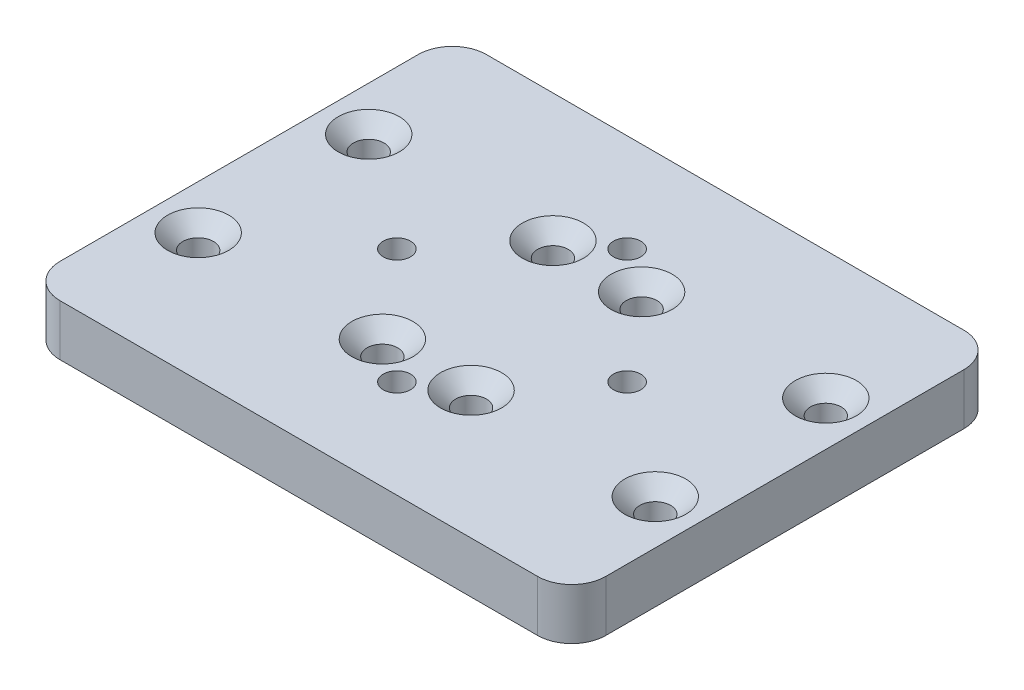
from build123d import *

# Parameters (mm, degrees)
DODANIE_WYCI_GNI_CIE1_DEPTH                        = 15
SZKIC2_R                                           = 4
WYTNIJ_WYCI_GNI_CIE1_DEPTH                         = 103.621878759
LUSTRO2_COPY_1_SKETCH_R                            = 4
LUSTRO2_COPY_1_DEPTH                               = 103.621878759
SFAZOWANIE1_SIZE                                   = 0.5
POG_BIENIE_STO_KOWE_POD_M8_WKR_T_Z_BEM_D           = 9
POG_BIENIE_STO_KOWE_POD_M8_WKR_T_Z_BEM_CSINK_D     = 17.92
POG_BIENIE_STO_KOWE_POD_M8_WKR_T_Z_BEM_CSINK_ANGLE = 90
SZKIC5_R                                           = 4
WYTNIJ_WYCI_GNI_CIE2_DEPTH                         = 103.621878759


with BuildPart() as part:
    # Szkic1 → Dodanie-wyciągnięcie1 (new body)
    with BuildSketch(Plane(origin=(0, 0, 0), x_dir=(1, 0, 0), z_dir=(0, 1, 0))):
        with BuildLine():
            Line((-70, -62.5), (70, -62.5))
            ThreePointArc((70, -62.5), (77.071067812, -59.571067812), (80, -52.5))
            Line((80, -52.5), (80, 52.5))
            ThreePointArc((80, 52.5), (77.071067812, 59.571067812), (70, 62.5))
            Line((70, 62.5), (-70, 62.5))
            ThreePointArc((-70, 62.5), (-77.071067812, 59.571067812), (-80, 52.5))
            Line((-80, 52.5), (-80, -52.5))
            ThreePointArc((-80, -52.5), (-77.071067812, -59.571067812), (-70, -62.5))
        make_face()
    extrude(amount=DODANIE_WYCI_GNI_CIE1_DEPTH)

    # Szkic2 → Wytnij-wyciągnięcie1 (cut, symmetric)
    with BuildSketch(Plane(origin=(0, 15, 0), x_dir=(1, 0, 0), z_dir=(0, 1, 0))):
        with Locations(Location((-67, -25, 0), (0, 0, 270))):
            Circle(SZKIC2_R)
        with Locations(Location((-13, -25, 0), (0, 0, 90))):
            Circle(SZKIC2_R)
    wytnij_wyci_gni_cie1 = extrude(amount=WYTNIJ_WYCI_GNI_CIE1_DEPTH, both=True, mode=Mode.SUBTRACT)

    # Lustro1: Wytnij-wyciągnięcie1 across plane
    add(wytnij_wyci_gni_cie1.mirror(Plane.XY), mode=Mode.SUBTRACT)

    # Lustro2: Wytnij-wyciągnięcie1 across plane
    add(wytnij_wyci_gni_cie1.mirror(Plane(origin=(0, 0, 0), x_dir=(0, 0, 1), z_dir=(1, 0, 0))), mode=Mode.SUBTRACT)

    # Lustro2 copy 1 sketch → Lustro2 copy 1 (cut, symmetric)
    with BuildSketch(Plane(origin=(0, 15, 0), x_dir=(-1, 0, 0), z_dir=(0, 1, 0))):
        with Locations(Location((-67, -25, 0), (0, 0, 270))):
            Circle(LUSTRO2_COPY_1_SKETCH_R)
        with Locations(Location((-13, -25, 0), (0, 0, 90))):
            Circle(LUSTRO2_COPY_1_SKETCH_R)
    extrude(amount=LUSTRO2_COPY_1_DEPTH, both=True, mode=Mode.SUBTRACT)

    # Sfazowanie1
    sfazowanie1_edges = [part.edges().sort_by_distance(p)[0] for p in [
        (-67, 0, 21),
        (-67, 15, 21),
        (-13, 0, 29),
        (-13, 15, 29),
        (-67, 15, -21),
        (-67, 0, -21),
        (-13, 15, -29),
        (-13, 0, -29),
        (67, 0, -21),
        (67, 15, -21),
        (13, 0, -29),
        (13, 15, -29),
        (67, 15, 21),
        (67, 0, 21),
        (13, 15, 29),
        (13, 0, 29),
    ]]
    chamfer(sfazowanie1_edges, length=SFAZOWANIE1_SIZE)

    # Pogłębienie stożkowe pod M8 Wkręt z łbem stożkowym płaskim1 (through all)
    with Locations(Plane(origin=(0, 15, 0), x_dir=(1, 0, 0), z_dir=(0, 1, 0))):
        with Locations((-67, 25), (-13, 25), (-13, -25), (13, -25), (13, 25), (67, 25), (67, -25), (-67, -25)):
            CounterSinkHole(POG_BIENIE_STO_KOWE_POD_M8_WKR_T_Z_BEM_D / 2, POG_BIENIE_STO_KOWE_POD_M8_WKR_T_Z_BEM_CSINK_D / 2, counter_sink_angle=POG_BIENIE_STO_KOWE_POD_M8_WKR_T_Z_BEM_CSINK_ANGLE)

    # Szkic5 → Wytnij-wyciągnięcie2 (cut, through all)
    with BuildSketch(Plane(origin=(0, 15, 0), x_dir=(1, 0, 0), z_dir=(0, 1, 0))):
        with Locations(Location((0, 33.75, 0), (0, 0, 270))):
            Circle(SZKIC5_R)
        with Locations(Location((33.75, 0, 0), (0, 0, 270))):
            Circle(SZKIC5_R)
        with Locations(Location((0, -33.75, 0), (0, 0, 270))):
            Circle(SZKIC5_R)
        with Locations(Location((-33.75, 0, 0), (0, 0, 270))):
            Circle(SZKIC5_R)
    extrude(amount=-WYTNIJ_WYCI_GNI_CIE2_DEPTH, mode=Mode.SUBTRACT)


solid = part.part
